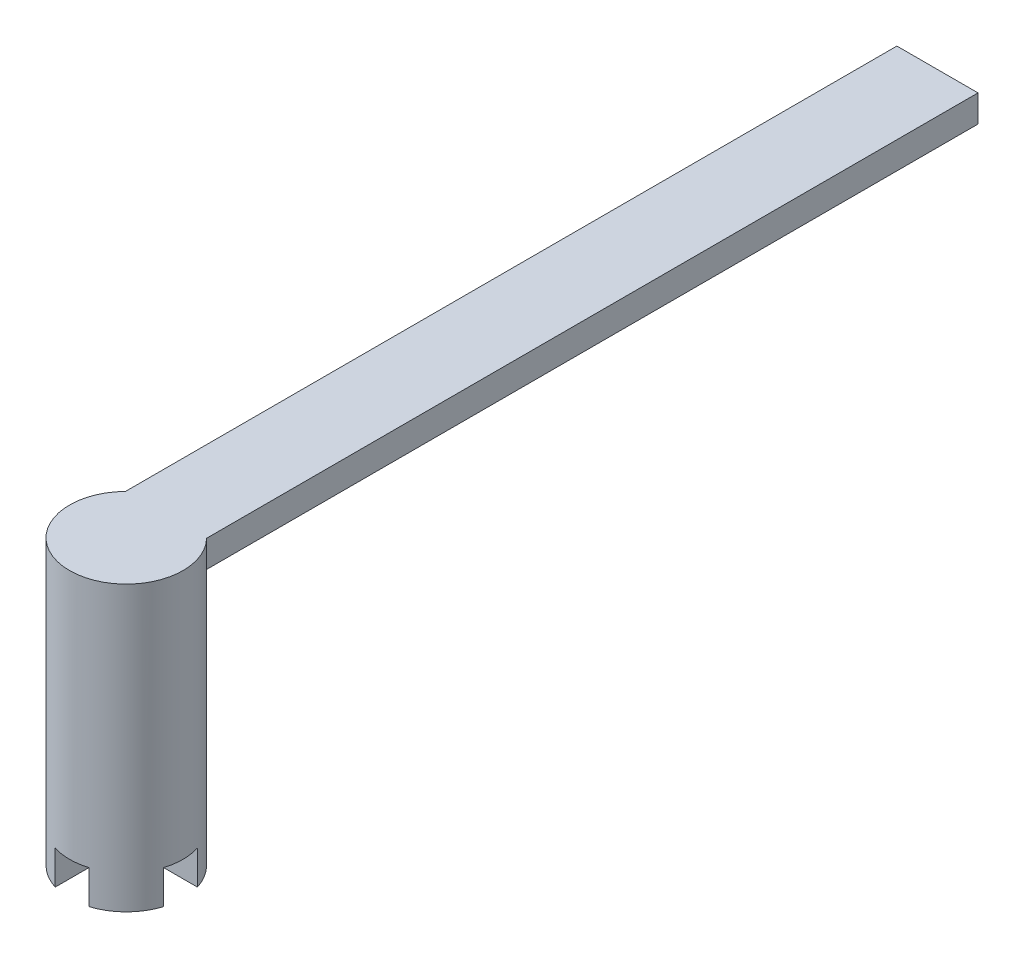
from build123d import *

# Parameters (mm, degrees)
SKETCH2_R           = 5.334
SKETCH2_W           = 7.62
SKETCH2_H           = 76.2
BOSS_EXTRUDE1_DEPTH = 2.54
BOSS_EXTRUDE2_START = 24.13
SKETCH3_R           = 5.334
BOSS_EXTRUDE2_DEPTH = 24.13
SKETCH4_W           = 3.175
SKETCH4_H           = 3.175
CUT_EXTRUDE1_DEPTH  = 3.175


with BuildPart() as part:
    # Sketch2 → Boss-Extrude1 (new body)
    with BuildSketch(Plane(origin=(0, 0, 0), x_dir=(1, 0, 0), z_dir=(0, 1, 0))):
        Circle(SKETCH2_R)
        with Locations((0, 38.1)):
            Rectangle(SKETCH2_W, SKETCH2_H)
    extrude(amount=BOSS_EXTRUDE1_DEPTH)

    # Sketch3 → Boss-Extrude2 (add)
    with BuildSketch(Plane.XZ.offset(BOSS_EXTRUDE2_START)):
        with Locations(Location((0, 0, 0), (0, 0, 270))):
            Circle(SKETCH3_R)
    extrude(amount=-BOSS_EXTRUDE2_DEPTH)

    # Sketch4 → Cut-Extrude1 (cut)
    with BuildSketch(Plane.XZ.offset(24.13)):
        with BuildLine():
            Line((-1.5875, -1.5875), (-1.5875, 1.5875))
            Line((-1.5875, 1.5875), (-5.092288263, 1.5875))
            ThreePointArc((-5.092288263, 1.5875), (-5.334, 0), (-5.092288263, -1.5875))
            Line((-5.092288263, -1.5875), (-1.5875, -1.5875))
        make_face()
        Rectangle(SKETCH4_W, SKETCH4_H)
        with BuildLine():
            ThreePointArc((1.5875, 5.092288263), (0, 5.334), (-1.5875, 5.092288263))
            Line((-1.5875, 5.092288263), (-1.5875, 1.5875))
            Line((-1.5875, 1.5875), (1.5875, 1.5875))
            Line((1.5875, 1.5875), (1.5875, 5.092288263))
        make_face()
        with BuildLine():
            Line((5.092288263, 1.5875), (1.5875, 1.5875))
            Line((1.5875, 1.5875), (1.5875, -1.5875))
            Line((1.5875, -1.5875), (5.092288263, -1.5875))
            ThreePointArc((5.092288263, -1.5875), (5.273225843, -0.802898003), (5.334, 0))
            ThreePointArc((5.334, 0), (5.273225843, 0.802898003), (5.092288263, 1.5875))
        make_face()
        with BuildLine():
            Line((1.5875, -1.5875), (-1.5875, -1.5875))
            Line((-1.5875, -1.5875), (-1.5875, -5.092288263))
            ThreePointArc((-1.5875, -5.092288263), (0, -5.334), (1.5875, -5.092288263))
            Line((1.5875, -5.092288263), (1.5875, -1.5875))
        make_face()
    extrude(amount=-CUT_EXTRUDE1_DEPTH, mode=Mode.SUBTRACT)


solid = part.part
